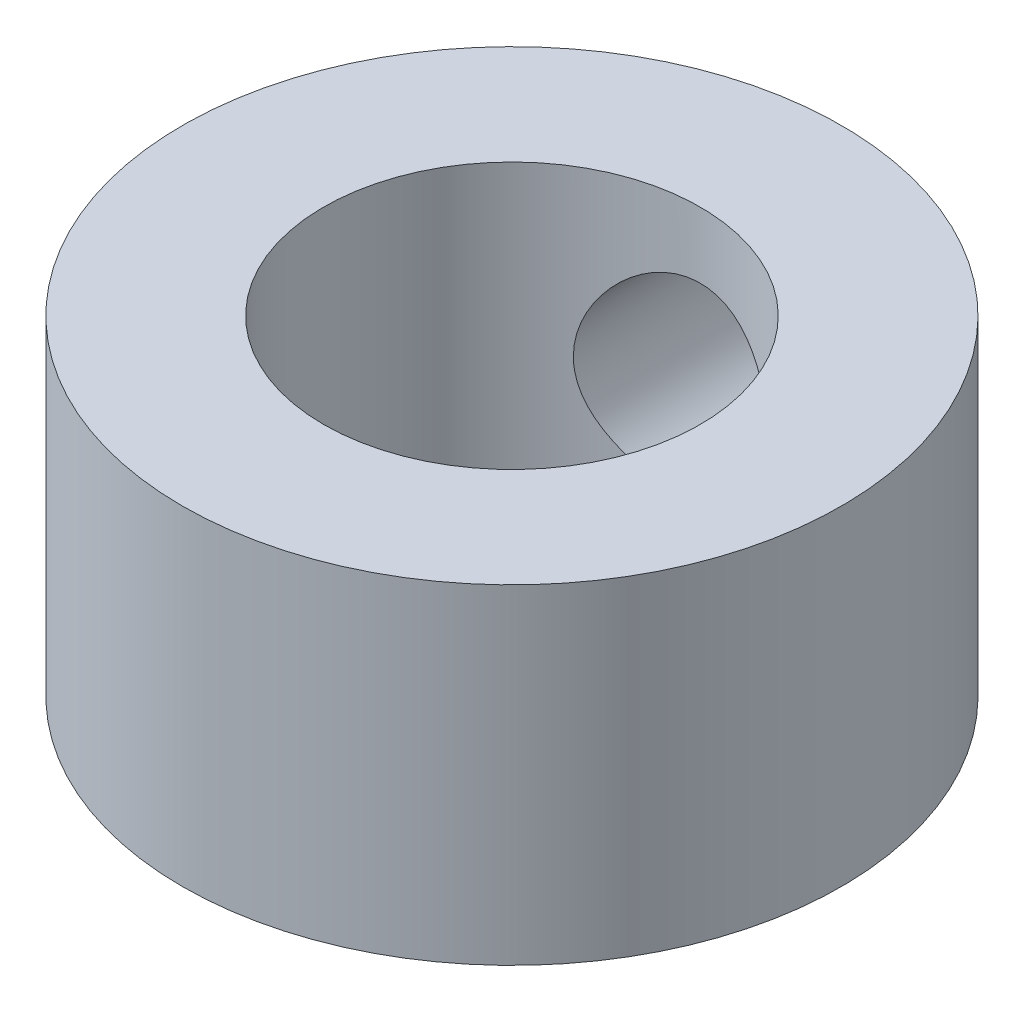
from build123d import *

# Parameters (mm, degrees)
SKETCH1_R                = 7
BOSS_EXTRUDE1_DEPTH      = 7
F_8_0_8_DIAMETER_HOLE1_D = 8
SKETCH11_R               = 2.1
CUT_EXTRUDE1_DEPTH       = 7


with BuildPart() as part:
    # Sketch1 → Boss-Extrude1 (new body)
    with BuildSketch(Plane(origin=(0, 0, 0), x_dir=(1, 0, 0), z_dir=(0, 1, 0))):
        with Locations(Location((0, 0, 0), (0, 0, 270))):
            Circle(SKETCH1_R)
    extrude(amount=BOSS_EXTRUDE1_DEPTH)

    # Ø8.0 (8) Diameter Hole1 (through all)
    with Locations(Plane(origin=(0, 7, 0), x_dir=(1, 0, 0), z_dir=(0, 1, 0))):
        with Locations((0, 0)):
            Hole(F_8_0_8_DIAMETER_HOLE1_D / 2)

    # Sketch11 → Cut-Extrude1 (cut)
    with BuildSketch(Plane(origin=(0, 0, -7), x_dir=(-1, 0, 0), z_dir=(0, 0, -1))):
        with Locations((0, 3.5)):
            Circle(SKETCH11_R)
    extrude(amount=-CUT_EXTRUDE1_DEPTH, mode=Mode.SUBTRACT)


solid = part.part
